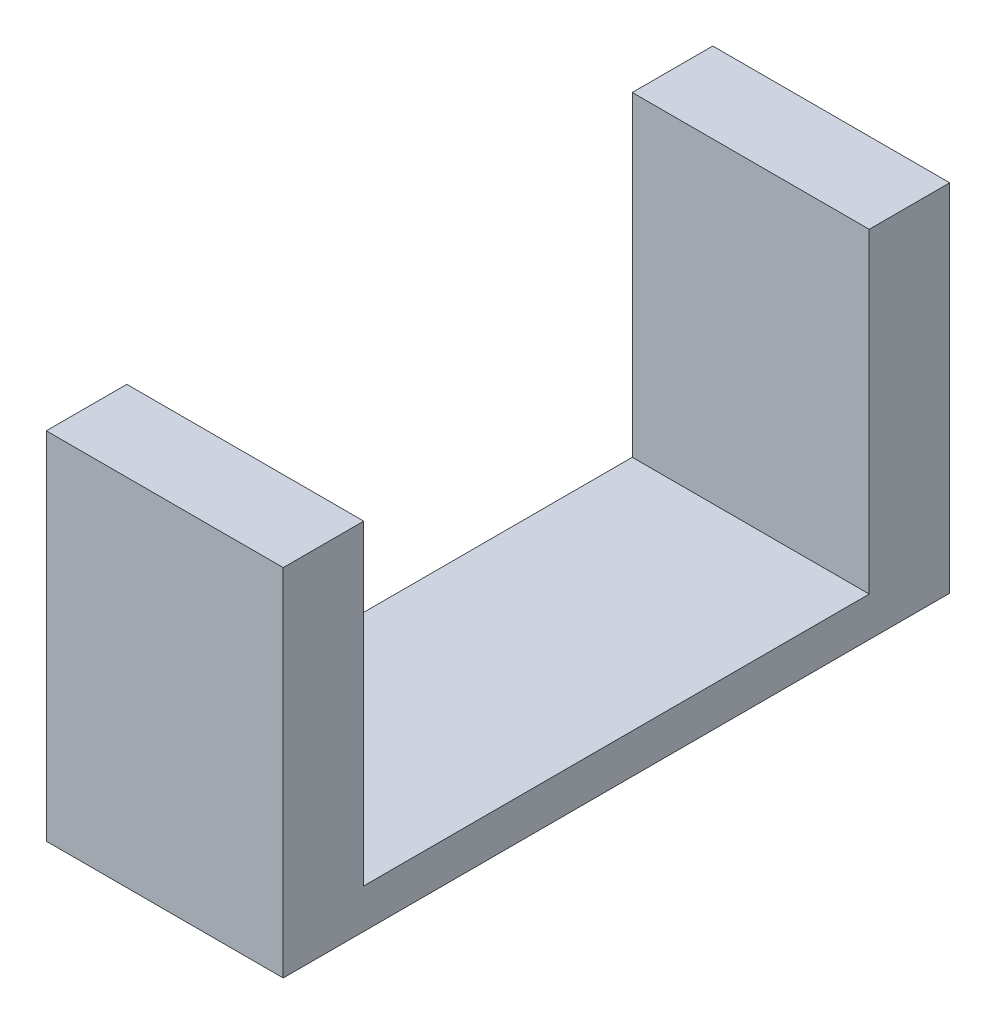
from build123d import *

# Parameters (mm, degrees)
SKETCH1_W           = 19.05
SKETCH1_H           = 53.584105048
BOSS_EXTRUDE1_DEPTH = 3.175
SKETCH1_3_W         = 19.05
SKETCH1_3_H         = 6.472052524
BOSS_EXTRUDE2_DEPTH = 28.575


with BuildPart() as part:
    # Sketch1 → Boss-Extrude1 (new body)
    with BuildSketch(Plane(origin=(0, 0, 0), x_dir=(1, 0, 0), z_dir=(0, 1, 0))):
        Rectangle(SKETCH1_W, SKETCH1_H)
    extrude(amount=BOSS_EXTRUDE1_DEPTH)

    # Sketch1<3> → Boss-Extrude2 (add)
    with BuildSketch(Plane(origin=(0, 0, 0), x_dir=(1, 0, 0), z_dir=(0, 1, 0))):
        with Locations((0, 23.556026262)):
            Rectangle(SKETCH1_3_W, SKETCH1_3_H)
        with Locations((0, -23.556026262)):
            Rectangle(SKETCH1_3_W, SKETCH1_3_H)
    extrude(amount=BOSS_EXTRUDE2_DEPTH)


solid = part.part
